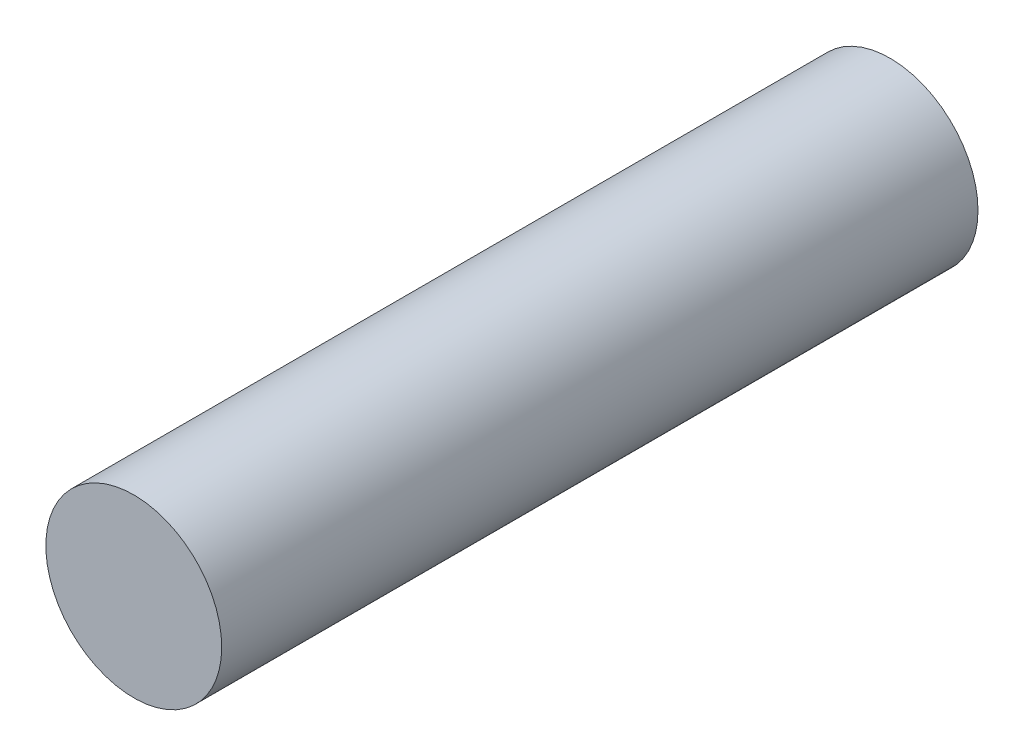
from build123d import *

# Parameters (mm, degrees)
SKETCH2_R           = 5
BOSS_EXTRUDE1_DEPTH = 43


with BuildPart() as part:
    # Sketch2 → Boss-Extrude1 (new body)
    with BuildSketch(Plane.XY):
        Circle(SKETCH2_R)
    extrude(amount=BOSS_EXTRUDE1_DEPTH)


solid = part.part
